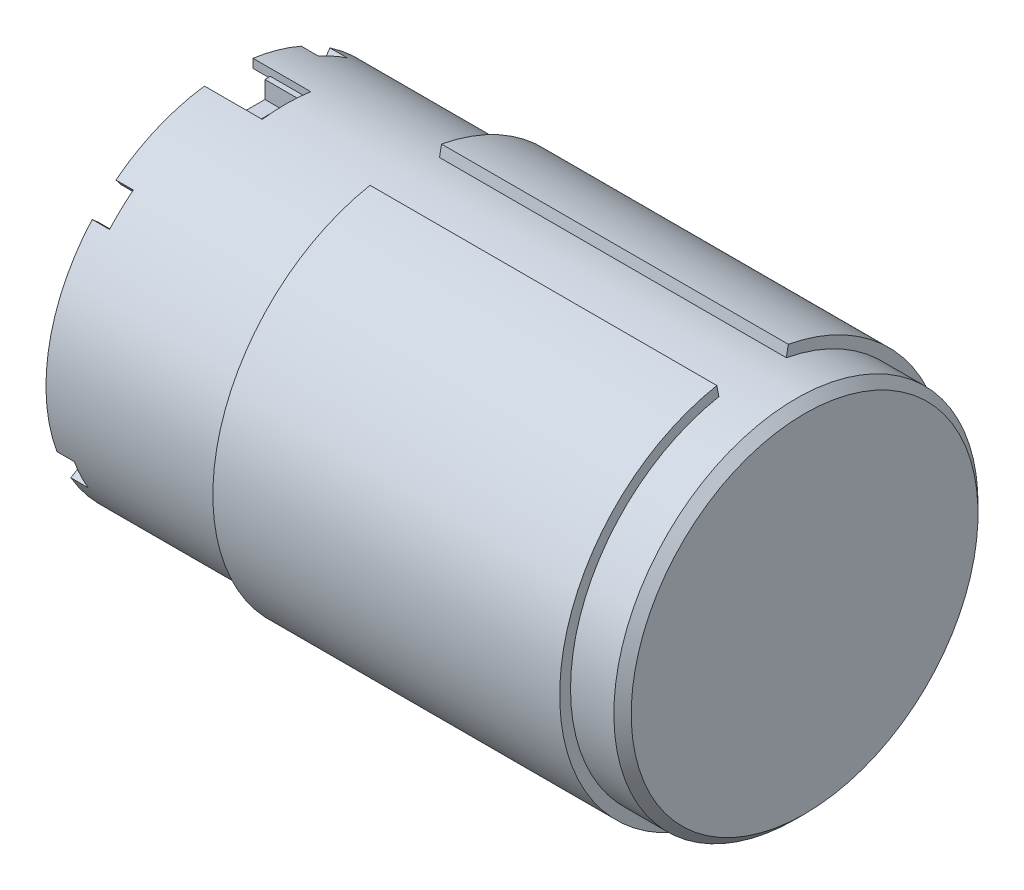
from build123d import *

# Parameters (mm, degrees)
CHAMFER2_SIZE      = 1
CUT_EXTRUDE1_START = -111
CUT_EXTRUDE1_DEPTH = 111
SKETCH3_W          = 6.659868337
SKETCH3_H          = 5.59204707
CUT_EXTRUDE2_DEPTH = 1
SKETCH4_W          = 5.737170607
SKETCH4_H          = 4.399946053
CUT_EXTRUDE3_DEPTH = 2
CUT_EXTRUDE4_DEPTH = 2
SKETCH6_W          = 0.57084709
SKETCH6_H          = 1.008895736
CUT_EXTRUDE5_DEPTH = 2


with BuildPart() as part:
    # Sketch1 → Revolve1 (revolve)
    with BuildSketch(Plane.XY, mode=Mode.PRIVATE) as revolve1_sk:
        Polygon((43.331874727, 0), (109.831874727, 0), (109.831874727, -21), (103.831874727, -21), (103.831874727, -22.25), (63.831874727, -22.25), (63.831874727, -21), (43.331874727, -21), align=None)
    revolve(revolve1_sk.sketch.rotate(Axis((169.06951142, 0, 0), (-1, 0, 0)), 180), axis=Axis((169.06951142, 0, 0), (-1, 0, 0)))

    # Chamfer2
    chamfer2_edges = [part.edges().sort_by_distance(p)[0] for p in [
        (109.831874727, -21, 0),
    ]]
    chamfer(chamfer2_edges, length=CHAMFER2_SIZE)

    # Sketch2 → Cut-Extrude1 (cut)
    with BuildSketch(Plane(origin=(103.831874727, 0, 0), x_dir=(0, 0, -1), z_dir=(1, 0, 0)).offset(CUT_EXTRUDE1_START)):
        with BuildLine():
            Line((-4.120122391, 21.865202754), (-3.888654841, 20.636820577))
            ThreePointArc((-3.888654841, 20.636820577), (0, 21), (3.888654841, 20.636820577))
            Line((3.888654841, 20.636820577), (4.120122391, 21.865202754))
            ThreePointArc((4.120122391, 21.865202754), (0, 22.25), (-4.120122391, 21.865202754))
        make_face()
        with BuildLine():
            ThreePointArc((3.888654841, -20.636820577), (0, -21), (-3.888654841, -20.636820577))
            Line((-3.888654841, -20.636820577), (-4.120122391, -21.865202754))
            ThreePointArc((-4.120122391, -21.865202754), (0, -22.25), (4.120122391, -21.865202754))
            Line((4.120122391, -21.865202754), (3.888654841, -20.636820577))
        make_face()
    extrude(amount=CUT_EXTRUDE1_DEPTH, mode=Mode.SUBTRACT)

    # Sketch3 → Cut-Extrude2 (cut)
    with BuildSketch(Plane(origin=(0, 21, 0), x_dir=(1, 0, 0), z_dir=(0, 1, 0))):
        with Locations((46.661808896, 0.080549256)):
            Rectangle(SKETCH3_W, SKETCH3_H)
    extrude(amount=-CUT_EXTRUDE2_DEPTH, mode=Mode.SUBTRACT)

    # Sketch4 → Cut-Extrude3 (cut)
    with BuildSketch(Plane(origin=(0, 20, 0), x_dir=(1, 0, 0), z_dir=(0, 1, 0))):
        with Locations((46.200460031, 0.055345837)):
            Rectangle(SKETCH4_W, SKETCH4_H)
    extrude(amount=-CUT_EXTRUDE3_DEPTH, mode=Mode.SUBTRACT)

    # Sketch5 → Cut-Extrude4 (cut)
    with BuildSketch(Plane.ZY.offset(-43.331874727)):
        with BuildLine():
            ThreePointArc((14.925071035, 13.313236068), (13.674240438, 14.595038488), (12.31375629, 15.759803489))
            ThreePointArc((12.31375629, 15.759803489), (7.517637174, 18.533351864), (2.144627189, 19.884681899))
            Line((2.144627189, 19.884681899), (2.144627189, 18))
            Line((2.144627189, 18), (-2.255318864, 18))
            Line((-2.255318864, 18), (-2.255318864, 19.872431578))
            ThreePointArc((-2.255318864, 19.872431578), (-5.211421697, 19.309093296), (-8.049539324, 18.308602259))
            ThreePointArc((-8.049539324, 18.308602259), (-9.655133779, 17.5150904), (-11.183303846, 16.581125266))
            ThreePointArc((-11.183303846, 16.581125266), (-18.10627914, 8.494860547), (-19.899959931, -1.997897586))
            ThreePointArc((-19.899959931, -1.997897586), (-19.641441279, -3.770117305), (-19.225418173, -5.512104503))
            ThreePointArc((-19.225418173, -5.512104503), (-13.674240438, -14.595038488), (-4.249312288, -19.543370873))
            ThreePointArc((-4.249312288, -19.543370873), (-2.483944519, -19.845151036), (-0.698658033, -19.987793199))
            ThreePointArc((-0.698658033, -19.987793199), (9.655133779, -17.5150904), (17.273740508, -10.080569868))
            ThreePointArc((17.273740508, -10.080569868), (18.10627914, -8.494860547), (18.793623762, -6.841031054))
            ThreePointArc((18.793623762, -6.841031054), (19.696097015, -3.473292728), (20, 0))
            ThreePointArc((20, 0), (18.688250596, 7.123853568), (14.925071035, 13.313236068))
        make_face()
        with BuildLine():
            Line((2.144627189, 18), (2.144627189, 19.884681899))
            ThreePointArc((2.144627189, 19.884681899), (-0.055683744, 19.999922483), (-2.255318864, 19.872431578))
            Line((-2.255318864, 19.872431578), (-2.255318864, 18))
            Line((-2.255318864, 18), (2.144627189, 18))
        make_face()
        with BuildLine():
            ThreePointArc((-11.183303846, 16.581125266), (-9.655133779, 17.5150904), (-8.049539324, 18.308602259))
            Line((-8.049539324, 18.308602259), (-8.45201629, 19.224032372))
            ThreePointArc((-8.45201629, 19.224032372), (-10.137890468, 18.39084492), (-11.742469038, 17.410181529))
            Line((-11.742469038, 17.410181529), (-11.183303846, 16.581125266))
        make_face()
        with BuildLine():
            Line((12.929444105, 16.547793664), (12.31375629, 15.759803489))
            ThreePointArc((12.31375629, 15.759803489), (13.674240438, 14.595038488), (14.925071035, 13.313236068))
            Line((14.925071035, 13.313236068), (15.671324586, 13.978897872))
            ThreePointArc((15.671324586, 13.978897872), (14.357952459, 15.324790412), (12.929444105, 16.547793664))
        make_face()
        with BuildLine():
            Line((19.733304951, -7.183082606), (18.793623762, -6.841031054))
            ThreePointArc((18.793623762, -6.841031054), (18.10627914, -8.494860547), (17.273740508, -10.080569868))
            Line((17.273740508, -10.080569868), (18.137427533, -10.584598362))
            ThreePointArc((18.137427533, -10.584598362), (19.011593097, -8.919603575), (19.733304951, -7.183082606))
        make_face()
        with BuildLine():
            Line((-0.733590935, -20.987182859), (-0.698658033, -19.987793199))
            ThreePointArc((-0.698658033, -19.987793199), (-2.483944519, -19.845151036), (-4.249312288, -19.543370873))
            Line((-4.249312288, -19.543370873), (-4.461777902, -20.520539417))
            ThreePointArc((-4.461777902, -20.520539417), (-2.608141745, -20.837408587), (-0.733590935, -20.987182859))
        make_face()
        with BuildLine():
            ThreePointArc((-19.225418173, -5.512104503), (-19.641441279, -3.770117305), (-19.899959931, -1.997897586))
            Line((-19.899959931, -1.997897586), (-20.894957927, -2.097792465))
            ThreePointArc((-20.894957927, -2.097792465), (-20.623513343, -3.95862317), (-20.186689082, -5.787709728))
            Line((-20.186689082, -5.787709728), (-19.225418173, -5.512104503))
        make_face()
    extrude(amount=-CUT_EXTRUDE4_DEPTH, mode=Mode.SUBTRACT)

    # Sketch6 → Cut-Extrude5 (cut)
    with BuildSketch(Plane.ZY.offset(-43.331874727)):
        with Locations((2.430050734, 20.319245355)):
            Rectangle(SKETCH6_W, SKETCH6_H)
        Polygon((-2.876572791, 20.802051076), (-2.876572791, 19.720628681), (-2.255318864, 19.720628681), (-2.255318864, 20.908214592), (-2.876572791, 20.908214592), align=None)
    extrude(amount=-CUT_EXTRUDE5_DEPTH, mode=Mode.SUBTRACT)


solid = part.part
